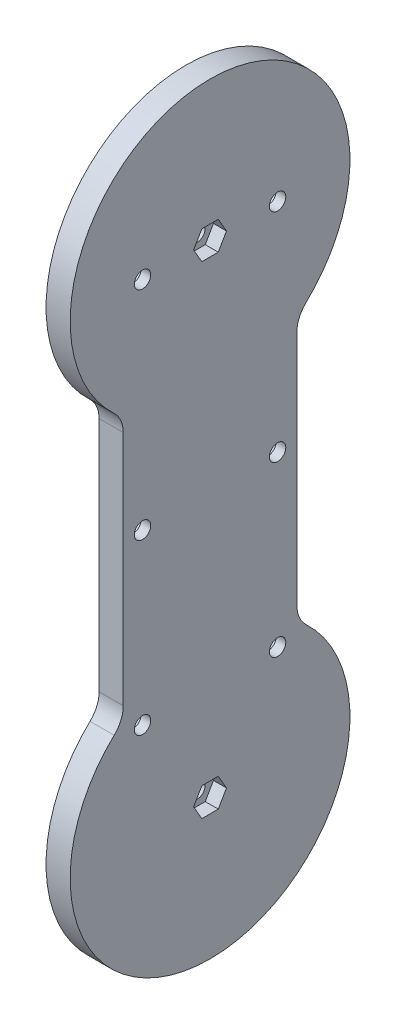
from build123d import *

# Parameters (mm, degrees)
PLATE_START        = -27.05
PLATE_B_DEPTH      = 5
PIN_START          = -27.25
SKETCH2_R          = 7.25
PIN_SEATS_DEPTH    = 1.2
BOLT_START         = -27.25
SKETCH3_R          = 1.7
BOLT_HOLES_DEPTH   = 5.4
PIN_START_2        = -24.75
PIN_NUTS_DEPTH     = 2.9
COUNTERBORES_START = -27.25
SKETCH5_R          = 3.2
COUNTERBORES_DEPTH = 3.2


with BuildPart() as part:
    # Sketch1 → Plate B (new body)
    with BuildSketch(Plane(origin=(0, 0, 0), x_dir=(0, 0, -1), z_dir=(1, 0, 0)).offset(PLATE_START)):
        with BuildLine():
            Line((-32, 127.975478406), (-32, 177.024521594))
            ThreePointArc((-32, 177.024521594), (-32.49156491, 179.402996496), (-33.885714286, 181.391746464))
            ThreePointArc((-33.885714286, 181.391746464), (-14, 231.5), (5.885714286, 181.391746464))
            ThreePointArc((5.885714286, 181.391746464), (4.49156491, 179.402996496), (4, 177.024521594))
            Line((4, 177.024521594), (4, 127.975478406))
            ThreePointArc((4, 127.975478406), (4.49156491, 125.597003504), (5.885714286, 123.608253536))
            ThreePointArc((5.885714286, 123.608253536), (-14, 73.5), (-33.885714286, 123.608253536))
            ThreePointArc((-33.885714286, 123.608253536), (-32.49156491, 125.597003504), (-32, 127.975478406))
        make_face()
    extrude(amount=PLATE_B_DEPTH)

    # Sketch2 → Pin seats (cut)
    with BuildSketch(Plane(origin=(0, 0, 0), x_dir=(0, 0, -1), z_dir=(1, 0, 0)).offset(PIN_START)):
        with Locations((-14, 102.5)):
            Circle(SKETCH2_R)
        with Locations((-14, 202.5)):
            Circle(SKETCH2_R)
    extrude(amount=PIN_SEATS_DEPTH, mode=Mode.SUBTRACT)

    # Sketch3 → Bolt holes (cut)
    with BuildSketch(Plane(origin=(0, 0, 0), x_dir=(0, 0, -1), z_dir=(1, 0, 0)).offset(BOLT_START)):
        with Locations((-14, 102.5)):
            Circle(SKETCH3_R)
        with Locations((-14, 202.5)):
            Circle(SKETCH3_R)
        with Locations((0, 122.5)):
            Circle(SKETCH3_R)
        with Locations((-28, 122.5)):
            Circle(SKETCH3_R)
        with Locations((0, 157.5)):
            Circle(SKETCH3_R)
        with Locations((-28, 157.5)):
            Circle(SKETCH3_R)
        with Locations((0, 202.5)):
            Circle(SKETCH3_R)
        with Locations((-28, 202.5)):
            Circle(SKETCH3_R)
    extrude(amount=BOLT_HOLES_DEPTH, mode=Mode.SUBTRACT)

    # Sketch4 → Pin nuts (cut)
    with BuildSketch(Plane(origin=(0, 0, 0), x_dir=(0, 0, -1), z_dir=(1, 0, 0)).offset(PIN_START_2)):
        Polygon((-15.703183294, 105.45), (-17.406366588, 102.5), (-15.703183294, 99.55), (-12.296816706, 99.55), (-10.593633412, 102.5), (-12.296816706, 105.45), align=None)
        Polygon((-15.703183294, 205.45), (-17.406366588, 202.5), (-15.703183294, 199.55), (-12.296816706, 199.55), (-10.593633412, 202.5), (-12.296816706, 205.45), align=None)
    extrude(amount=PIN_NUTS_DEPTH, mode=Mode.SUBTRACT)

    # Sketch5 → Counterbores (cut)
    with BuildSketch(Plane(origin=(0, 0, 0), x_dir=(0, 0, -1), z_dir=(1, 0, 0)).offset(COUNTERBORES_START)):
        with Locations((0, 122.5)):
            Circle(SKETCH5_R)
        with Locations((-28, 122.5)):
            Circle(SKETCH5_R)
        with Locations((0, 157.5)):
            Circle(SKETCH5_R)
        with Locations((-28, 157.5)):
            Circle(SKETCH5_R)
        with Locations((0, 202.5)):
            Circle(SKETCH5_R)
        with Locations((-28, 202.5)):
            Circle(SKETCH5_R)
    extrude(amount=COUNTERBORES_DEPTH, mode=Mode.SUBTRACT)


solid = part.part
